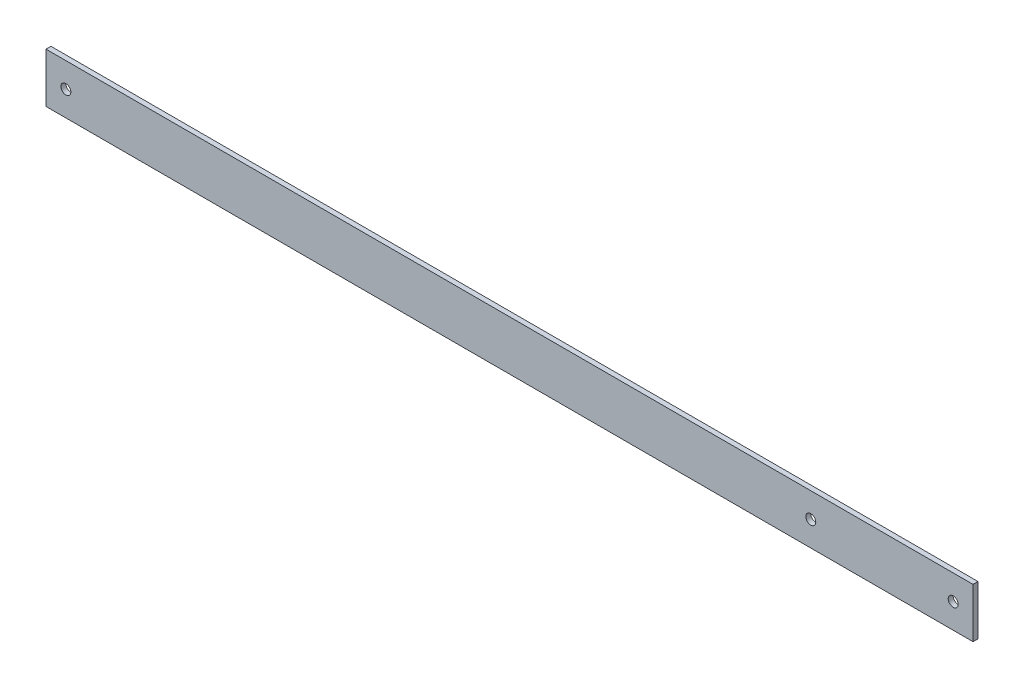
from build123d import *

# Parameters (mm, degrees)
ESQUISSE1_W      = 280
ESQUISSE1_H      = 15
EXTRUSION1_DEPTH = 1.5
ESQUISSE2_R      = 1.5
EXTRUSION2_DEPTH = 1.5


with BuildPart() as part:
    # Esquisse1 → Extrusion1 (new body)
    with BuildSketch(Plane.XY):
        with Locations((-146.909577855, 1675.531969937)):
            Rectangle(ESQUISSE1_W, ESQUISSE1_H)
    extrude(amount=EXTRUSION1_DEPTH)

    # Esquisse2 → Extrusion2 (cut)
    with BuildSketch(Plane(origin=(0, 0, 0), x_dir=(-1, 0, 0), z_dir=(0, 0, -1))):
        with Locations((280.909577855, 1675.531969937)):
            Circle(ESQUISSE2_R)
        with Locations((12.909577855, 1675.531969937)):
            Circle(ESQUISSE2_R)
        with Locations((55.909577855, 1675.531969937)):
            Circle(ESQUISSE2_R)
    extrude(amount=-EXTRUSION2_DEPTH, mode=Mode.SUBTRACT)


solid = part.part
